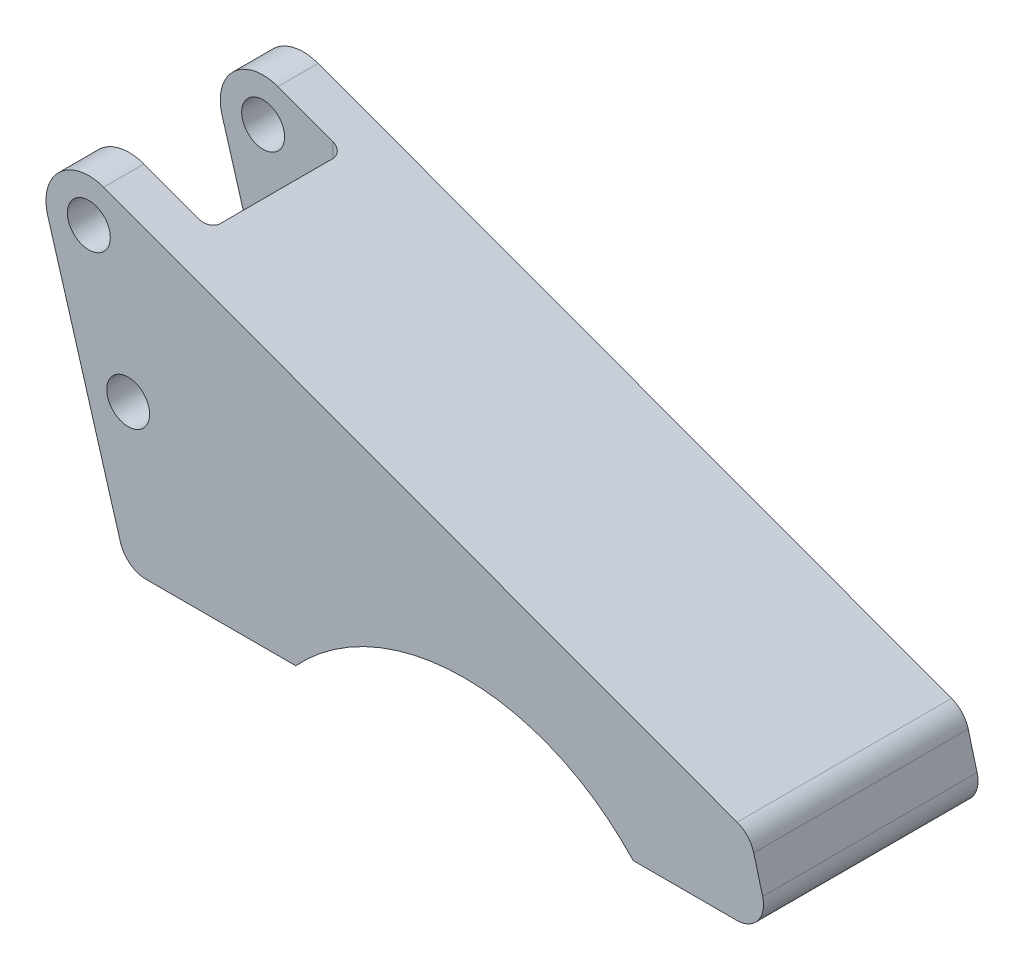
from build123d import *

# Parameters (mm, degrees)
SKETCH1_R               = 4
BOSS_EXTRUDE1_DEPTH     = 40
FILLET1_R               = 5
CUT_EXTRUDE1_DEPTH      = 142.850829854
CUT_EXTRUDE1_DEPTH_BACK = 142.850829854
SKETCH2_W               = 25
SKETCH2_H               = 25
FILLET2_R               = 2


with BuildPart() as part:
    # Sketch1 → Boss-Extrude1 (new body)
    with BuildSketch(Plane.XY):
        with BuildLine():
            Line((6.947546174, -51.87), (-7.673645346, -2.261673518))
            ThreePointArc((-7.673645346, -2.261673518), (-5.46693216, 5.840603801), (2.763356291, 7.507586963))
            Line((2.763356291, 7.507586963), (123.33, -36.87))
            Line((123.33, -36.87), (127.33, -51.87))
            Line((127.33, -51.87), (101.494792958, -51.87))
            ThreePointArc((101.494792958, -51.87), (70.04, -38.09), (38.585207042, -51.87))
            Line((38.585207042, -51.87), (6.947546174, -51.87))
        make_face()
        Circle(SKETCH1_R, mode=Mode.SUBTRACT)
        with Locations((7.33, -24.87)):
            Circle(SKETCH1_R, mode=Mode.SUBTRACT)
    extrude(amount=-BOSS_EXTRUDE1_DEPTH)

    # Fillet1
    fillet1_edges = [part.edges().sort_by_distance(p)[0] for p in [
        (6.947546174, -51.87, -20),
        (123.33, -36.87, -20),
        (127.33, -51.87, -20),
    ]]
    fillet(fillet1_edges, radius=FILLET1_R)

    # Sketch2 → Cut-Extrude1 (cut, two sides: drawn at the far end of the back side and taken through both)
    with BuildSketch(Plane(origin=(0, 0, 0), x_dir=(1, 0, 0), z_dir=(0, 1, 0)).offset(-CUT_EXTRUDE1_DEPTH_BACK)):
        with Locations((2.5, 20)):
            Rectangle(SKETCH2_W, SKETCH2_H)
    extrude(amount=CUT_EXTRUDE1_DEPTH + CUT_EXTRUDE1_DEPTH_BACK, mode=Mode.SUBTRACT)

    # Fillet2
    fillet2_edges = [part.edges().sort_by_distance(p)[0] for p in [
        (15, -24.433208829, -7.5),
        (15, -24.433208829, -32.5),
    ]]
    fillet(fillet2_edges, radius=FILLET2_R)


solid = part.part
